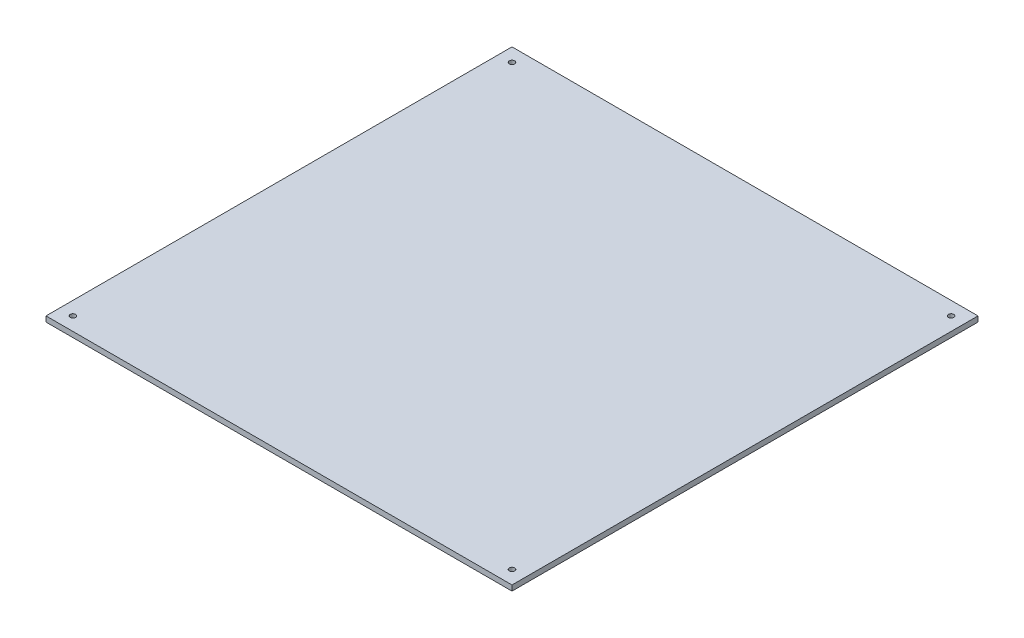
from build123d import *

# Parameters (mm, degrees)
ESBO_O1_W                = 260
ESBO_O1_H                = 260
ESBO_O1_R                = 1.5
RESSALTO_EXTRUS_O1_DEPTH = 3


with BuildPart() as part:
    # Esboço1 → Ressalto-extrusão1 (new body)
    with BuildSketch(Plane(origin=(0, 0, 0), x_dir=(1, 0, 0), z_dir=(0, 1, 0))):
        Rectangle(ESBO_O1_W, ESBO_O1_H)
        with Locations(Location((-122.5, 122.5, 0), (0, 0, 270))):
            Circle(ESBO_O1_R, mode=Mode.SUBTRACT)
        with Locations(Location((-122.5, -122.5, 0), (0, 0, 270))):
            Circle(ESBO_O1_R, mode=Mode.SUBTRACT)
        with Locations(Location((122.5, -122.5, 0), (0, 0, 90))):
            Circle(ESBO_O1_R, mode=Mode.SUBTRACT)
        with Locations(Location((122.5, 122.5, 0), (0, 0, 90))):
            Circle(ESBO_O1_R, mode=Mode.SUBTRACT)
    extrude(amount=RESSALTO_EXTRUS_O1_DEPTH)


solid = part.part
